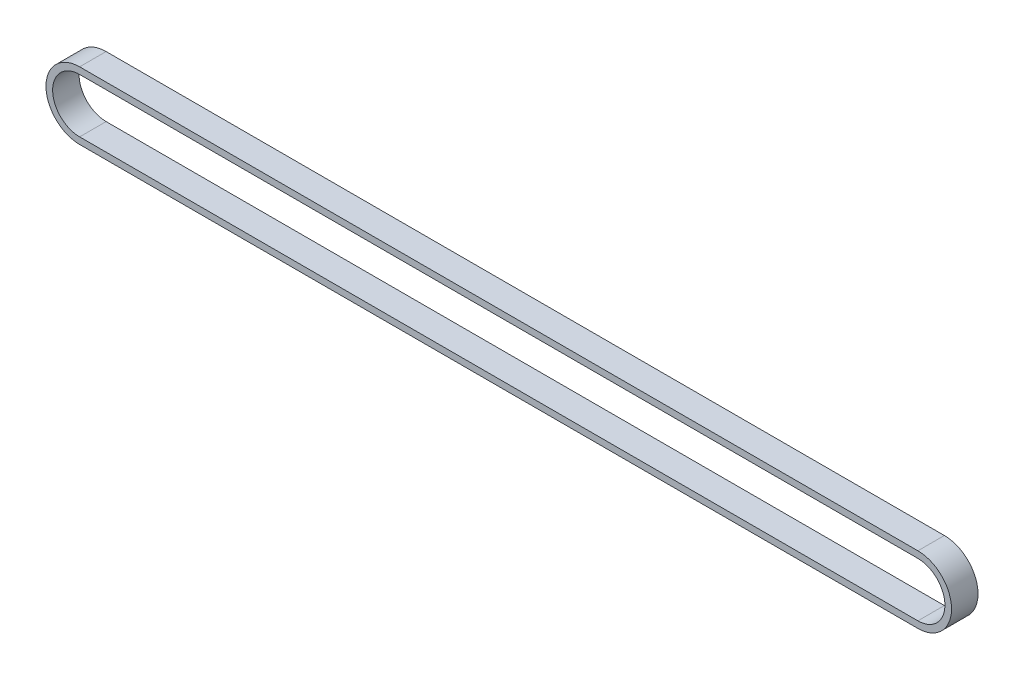
from build123d import *

# Parameters (mm, degrees)
BOSS_EXTRUDE1_DEPTH = 6


with BuildPart() as part:
    # Sketch4 → Boss-Extrude1 (new body)
    with BuildSketch(Plane.XY):
        with BuildLine():
            Line((0, 7.625), (190, 7.625))
            ThreePointArc((190, 7.625), (197.625, 0), (190, -7.625))
            Line((190, -7.625), (0, -7.625))
            ThreePointArc((0, -7.625), (-7.625, 0), (0, 7.625))
        make_face()
        with BuildLine():
            Line((0, 6.125), (190, 6.125))
            ThreePointArc((190, 6.125), (196.125, 0), (190, -6.125))
            Line((190, -6.125), (0, -6.125))
            ThreePointArc((0, -6.125), (-6.125, 0), (0, 6.125))
        make_face(mode=Mode.SUBTRACT)
    extrude(amount=BOSS_EXTRUDE1_DEPTH)


solid = part.part
